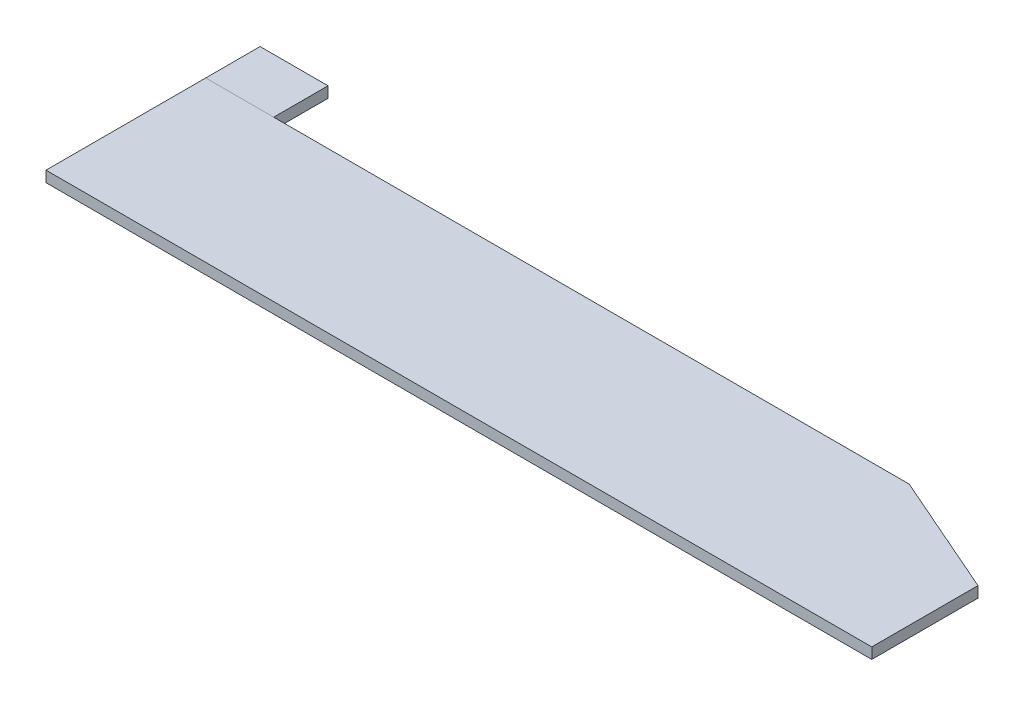
from build123d import *

# Parameters (mm, degrees)
BOSS_EXTRUDE1_DEPTH = 1.6
SKETCH2_W           = 10
SKETCH2_H           = 8
BOSS_EXTRUDE2_DEPTH = 1.6


with BuildPart() as part:
    # Sketch1 → Boss-Extrude1 (new body)
    with BuildSketch(Plane(origin=(0, 0, 0), x_dir=(1, 0, 0), z_dir=(0, 1, 0))):
        Polygon((-43.44244898, 9.167959184), (-43.44244898, -14.332040816), (78.05755102, -14.332040816), (78.05755102, 1.297959184), (60.05755102, 9.167959184), align=None)
    extrude(amount=BOSS_EXTRUDE1_DEPTH)


with BuildPart() as body_2:
    # Sketch2 → Boss-Extrude2 (new body)
    with BuildSketch(Plane(origin=(0, 1.6, 0), x_dir=(1, 0, 0), z_dir=(0, 1, 0))):
        with Locations((-38.44244898, 13.167959184)):
            Rectangle(SKETCH2_W, SKETCH2_H)
    extrude(amount=-BOSS_EXTRUDE2_DEPTH)


solid = Compound([part.part, body_2.part])
